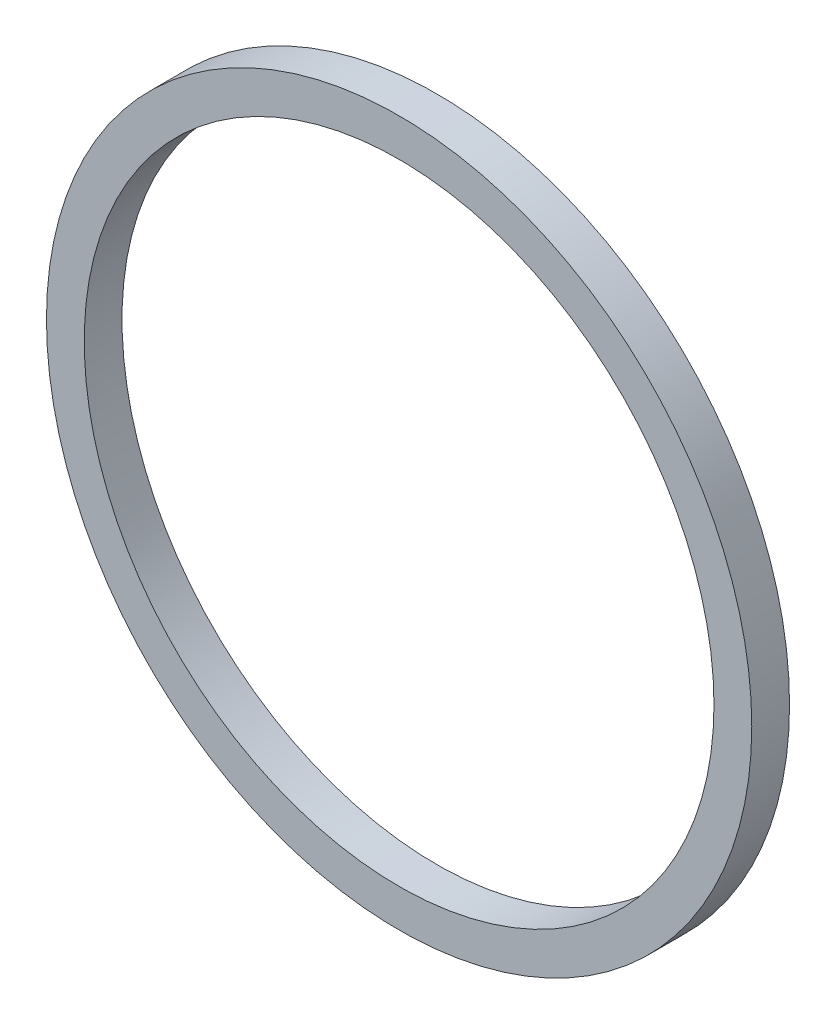
from build123d import *

# Parameters (mm, degrees)
SKETCH1_R           = 14
SKETCH1_R_2         = 12.5
BOSS_EXTRUDE1_DEPTH = 1.5


with BuildPart() as part:
    # Sketch1 → Boss-Extrude1 (new body)
    with BuildSketch(Plane.XY):
        Circle(SKETCH1_R)
        Circle(SKETCH1_R_2, mode=Mode.SUBTRACT)
    extrude(amount=BOSS_EXTRUDE1_DEPTH)


solid = part.part
